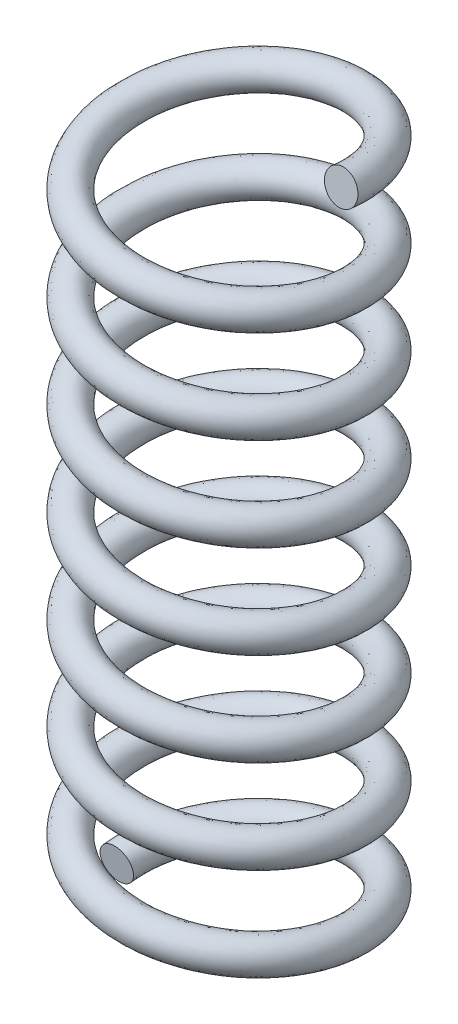
from build123d import *

# Parameters (mm, degrees)
SWEEP1_PITCH       = 2.8
SWEEP1_HEIGHT      = 21
SWEEP1_RADIUS      = 3.375
SWEEP1_START_ANGLE = -90
SWEEP1_PROFILE_R   = 0.5


with BuildPart() as part:
    # Sweep1: sweep along a helix
    with BuildLine() as sweep1_path:
        add(Helix(SWEEP1_PITCH, SWEEP1_HEIGHT, SWEEP1_RADIUS, center=(0, 0, 0), direction=(0, 1, 0), lefthand=True, mode=Mode.PRIVATE).rotate(Axis((0, 0, 0), (0, 1, 0)), SWEEP1_START_ANGLE))
    # Sweep1 profile (on start of the path) → Sweep1 (sweep)
    with BuildSketch(Plane(origin=(-3.375, 0, 0), x_dir=(0, -0.9913951186597982, -0.13090347091473428), z_dir=(1.6006657360240448e-13, 0.13090347091473428, -0.9913951186597982))):
        Circle(SWEEP1_PROFILE_R)
    sweep(path=sweep1_path.line, is_frenet=True)


solid = part.part
